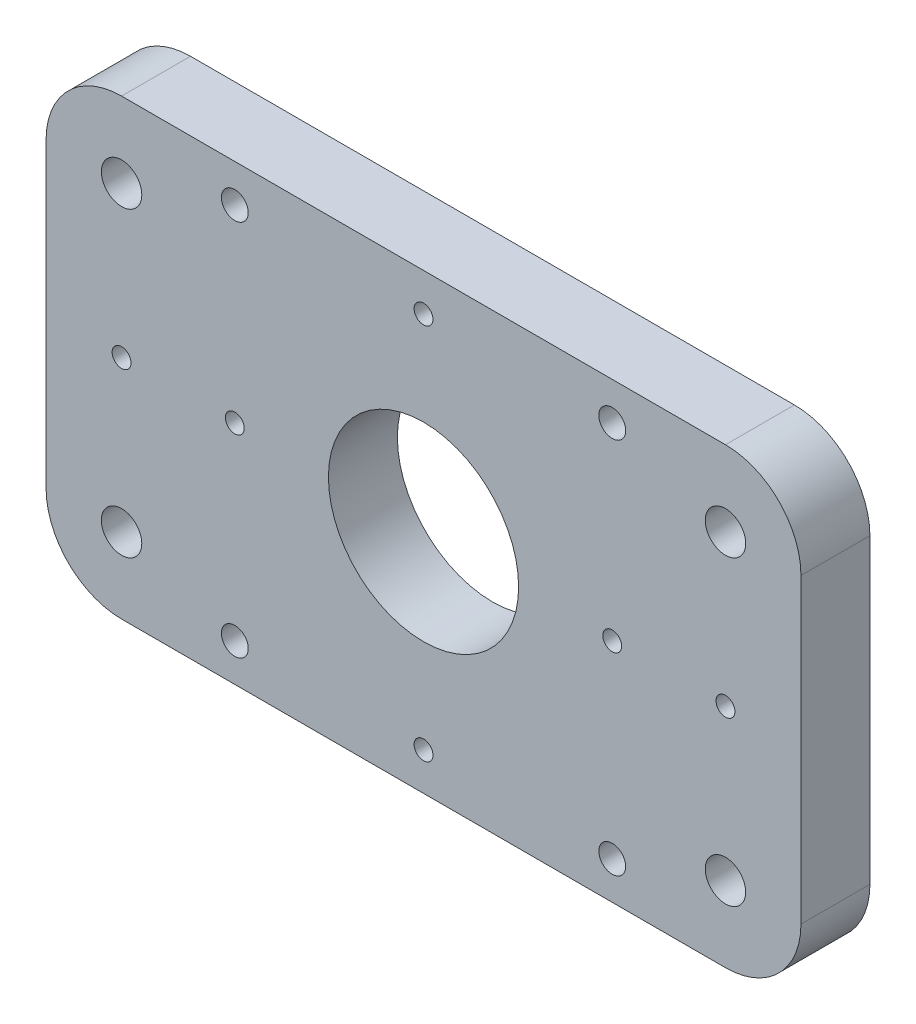
from build123d import *

# Parameters (mm, degrees)
SKETCH1_W                = 38.1
SKETCH1_H                = 38.1
BOSS_EXTRUDE1_DEPTH      = 5.8
SKETCH2_R                = 8
CUT_EXTRUDE1_DEPTH       = 12.7
SKETCH3_R                = 1.13
CUT_EXTRUDE2_DEPTH       = 55.19280395
SKETCH4_R                = 0.79375
CUT_EXTRUDE3_DEPTH       = 55.19280395
SKETCH5_W                = 12.7
SKETCH5_H                = 38.1
BOSS_EXTRUDE2_DEPTH      = 5.8
M3_CLEARANCE_HOLE1_D     = 3.4
M3_CLEARANCE_HOLE1_DEPTH = 10
M3_CLEARANCE_HOLE1_TIP   = 1.021463052
SKETCH9_R                = 0.79375
CUT_EXTRUDE4_DEPTH       = 64.764331722
FILLET1_R                = 6.35


with BuildPart() as part:
    # Sketch1 → Boss-Extrude1 (new body)
    with BuildSketch(Plane.XY):
        with Locations((-19.05, 19.05)):
            Rectangle(SKETCH1_W, SKETCH1_H)
    extrude(amount=BOSS_EXTRUDE1_DEPTH)

    # Sketch2 → Cut-Extrude1 (cut)
    with BuildSketch(Plane.XY.offset(5.8)):
        with Locations((-19.05, 19.05)):
            Circle(SKETCH2_R)
    extrude(amount=-CUT_EXTRUDE1_DEPTH, mode=Mode.SUBTRACT)

    # Sketch3 → Cut-Extrude2 (cut, through all)
    with BuildSketch(Plane.XY.offset(5.8)):
        with Locations((-34.925, 34.925)):
            Circle(SKETCH3_R)
        with Locations((-3.175, 34.925)):
            Circle(SKETCH3_R)
        with Locations((-3.175, 3.175)):
            Circle(SKETCH3_R)
        with Locations((-34.925, 3.175)):
            Circle(SKETCH3_R)
    extrude(amount=-CUT_EXTRUDE2_DEPTH, mode=Mode.SUBTRACT)

    # Sketch4 → Cut-Extrude3 (cut, through all)
    with BuildSketch(Plane.XY.offset(5.8)):
        with Locations((-34.925, 19.05)):
            Circle(SKETCH4_R)
        with Locations((-19.05, 34.925)):
            Circle(SKETCH4_R)
        with Locations((-3.175, 19.05)):
            Circle(SKETCH4_R)
        with Locations((-19.05, 3.175)):
            Circle(SKETCH4_R)
    extrude(amount=-CUT_EXTRUDE3_DEPTH, mode=Mode.SUBTRACT)

    # Sketch5 → Boss-Extrude2 (add, through all)
    with BuildSketch(Plane.XY.offset(5.8)):
        with Locations((-44.45, 19.05)):
            Rectangle(SKETCH5_W, SKETCH5_H)
        with Locations((6.35, 19.05)):
            Rectangle(SKETCH5_W, SKETCH5_H)
    extrude(amount=-BOSS_EXTRUDE2_DEPTH)

    # M3 Clearance Hole1
    with Locations(Plane(origin=(0, 0, 0), x_dir=(-1, 0, 0), z_dir=(0, 0, -1))):
        with Locations((-6.35, 31.75), (44.45, 31.75), (44.45, 6.35), (-6.35, 6.35)):
            Hole(M3_CLEARANCE_HOLE1_D / 2, depth=M3_CLEARANCE_HOLE1_DEPTH)
            with Locations((0, 0, -(M3_CLEARANCE_HOLE1_DEPTH + M3_CLEARANCE_HOLE1_TIP / 2))):  # 118° drill point
                Cone(0, M3_CLEARANCE_HOLE1_D / 2, M3_CLEARANCE_HOLE1_TIP, mode=Mode.SUBTRACT)

    # Sketch9 → Cut-Extrude4 (cut, through all)
    with BuildSketch(Plane(origin=(0, 0, 0), x_dir=(-1, 0, 0), z_dir=(0, 0, -1))):
        with Locations((-6.35, 19.05)):
            Circle(SKETCH9_R)
        with Locations((44.45, 19.05)):
            Circle(SKETCH9_R)
    extrude(amount=-CUT_EXTRUDE4_DEPTH, mode=Mode.SUBTRACT)

    # Fillet1
    fillet1_edges = [part.edges().sort_by_distance(p)[0] for p in [
        (-50.8, 0, 2.9),
        (-50.8, 38.1, 2.9),
        (12.7, 38.1, 2.9),
        (12.7, 0, 2.9),
    ]]
    fillet(fillet1_edges, radius=FILLET1_R)


solid = part.part
